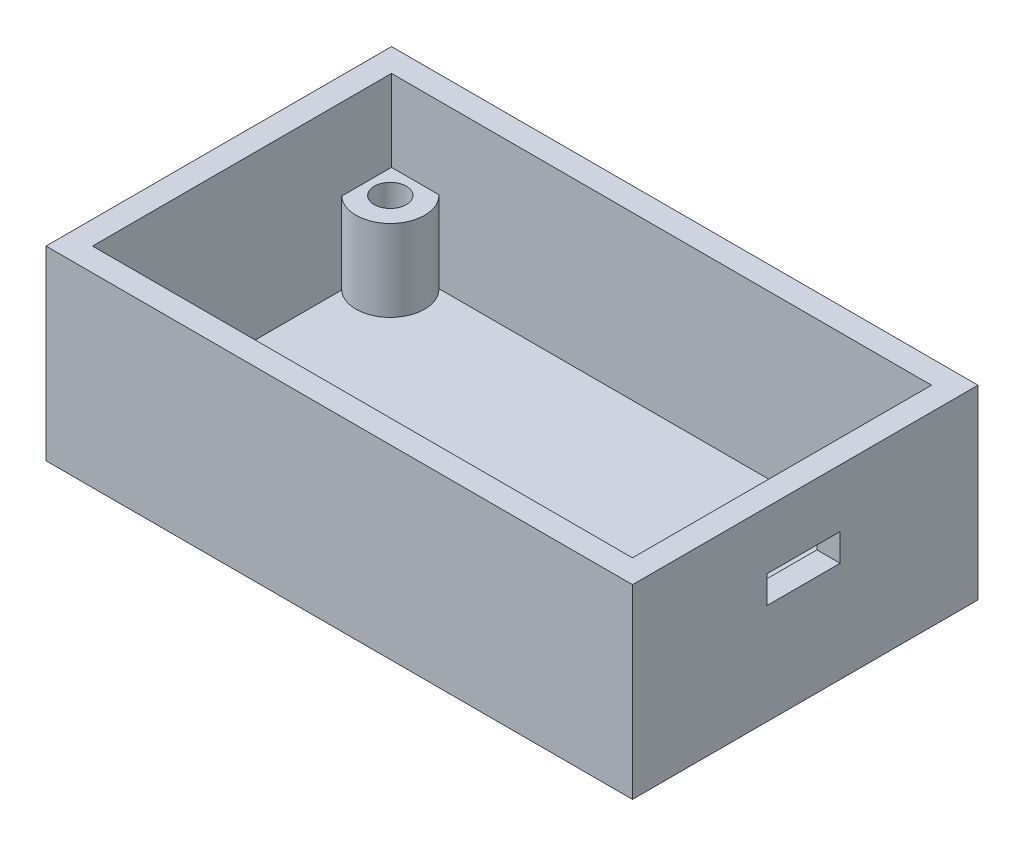
from build123d import *

# Parameters (mm, degrees)
SKETCH1_W           = 64.08
SKETCH1_H           = 37.749
BOSS_EXTRUDE1_DEPTH = 20.32
SKETCH1_6_W         = 59
SKETCH1_6_H         = 32.669
CUT_EXTRUDE1_DEPTH  = 17.78
SKETCH4_R           = 1.75
BOSS_EXTRUDE2_DEPTH = 8.89
SKETCH6_W           = 8
SKETCH6_H           = 3
CUT_EXTRUDE2_DEPTH  = 8.89


with BuildPart() as part:
    # Sketch1 → Boss-Extrude1 (new body)
    with BuildSketch(Plane(origin=(0, 0, 0), x_dir=(1, 0, 0), z_dir=(0, 1, 0))):
        Rectangle(SKETCH1_W, SKETCH1_H)
    extrude(amount=-BOSS_EXTRUDE1_DEPTH)

    # Sketch1<6> → Cut-Extrude1 (cut)
    with BuildSketch(Plane(origin=(0, 0, 0), x_dir=(1, 0, 0), z_dir=(0, 1, 0))):
        Rectangle(SKETCH1_6_W, SKETCH1_6_H)
    extrude(amount=-CUT_EXTRUDE1_DEPTH, mode=Mode.SUBTRACT)

    # Sketch4 → Boss-Extrude2 (add)
    # profile 1 of 4: a face of its own
    with BuildSketch(Plane(origin=(0, -17.78, 0), x_dir=(1, 0, 0), z_dir=(0, 1, 0))):
        with BuildLine():
            Line((-29.5, 16.3345), (-24.3228, 16.3345))
            ThreePointArc((-24.3228, 16.3345), (-24.192690413, 11.027190413), (-29.5, 10.897080827))
            Line((-29.5, 10.897080827), (-29.5, 16.3345))
        make_face()
        with Locations((-26.9114, 13.615790413)):
            Circle(SKETCH4_R, mode=Mode.SUBTRACT)
    # profile 2 of 4: a face of its own
    with BuildSketch(Plane(origin=(0, -17.78, 0), x_dir=(1, 0, 0), z_dir=(0, 1, 0))):
        with BuildLine():
            Line((29.5, 10.897080827), (29.5, 16.3345))
            Line((29.5, 16.3345), (24.3228, 16.3345))
            ThreePointArc((24.3228, 16.3345), (24.192690413, 11.027190413), (29.5, 10.897080827))
        make_face()
        with Locations((26.9114, 13.615790413)):
            Circle(SKETCH4_R, mode=Mode.SUBTRACT)
    # profile 3 of 4: a face of its own
    with BuildSketch(Plane(origin=(0, -17.78, 0), x_dir=(1, 0, 0), z_dir=(0, 1, 0))):
        with BuildLine():
            Line((29.5, -10.897080827), (29.5, -16.3345))
            Line((29.5, -16.3345), (24.3228, -16.3345))
            ThreePointArc((24.3228, -16.3345), (24.192690413, -11.027190413), (29.5, -10.897080827))
        make_face()
        with Locations((26.9114, -13.615790413)):
            Circle(SKETCH4_R, mode=Mode.SUBTRACT)
    # profile 4 of 4: a face of its own
    with BuildSketch(Plane(origin=(0, -17.78, 0), x_dir=(1, 0, 0), z_dir=(0, 1, 0))):
        with BuildLine():
            Line((-29.5, -10.897080827), (-29.5, -16.3345))
            Line((-29.5, -16.3345), (-24.3228, -16.3345))
            ThreePointArc((-24.3228, -16.3345), (-24.192690413, -11.027190413), (-29.5, -10.897080827))
        make_face()
        with Locations((-26.9114, -13.615790413)):
            Circle(SKETCH4_R, mode=Mode.SUBTRACT)
    extrude(amount=BOSS_EXTRUDE2_DEPTH)

    # Sketch6 → Cut-Extrude2 (cut)
    with BuildSketch(Plane(origin=(32.04, 0, 0), x_dir=(0, 0, -1), z_dir=(1, 0, 0))):
        with Locations((-0.19, -7.82)):
            Rectangle(SKETCH6_W, SKETCH6_H)
    extrude(amount=-CUT_EXTRUDE2_DEPTH, mode=Mode.SUBTRACT)


solid = part.part
